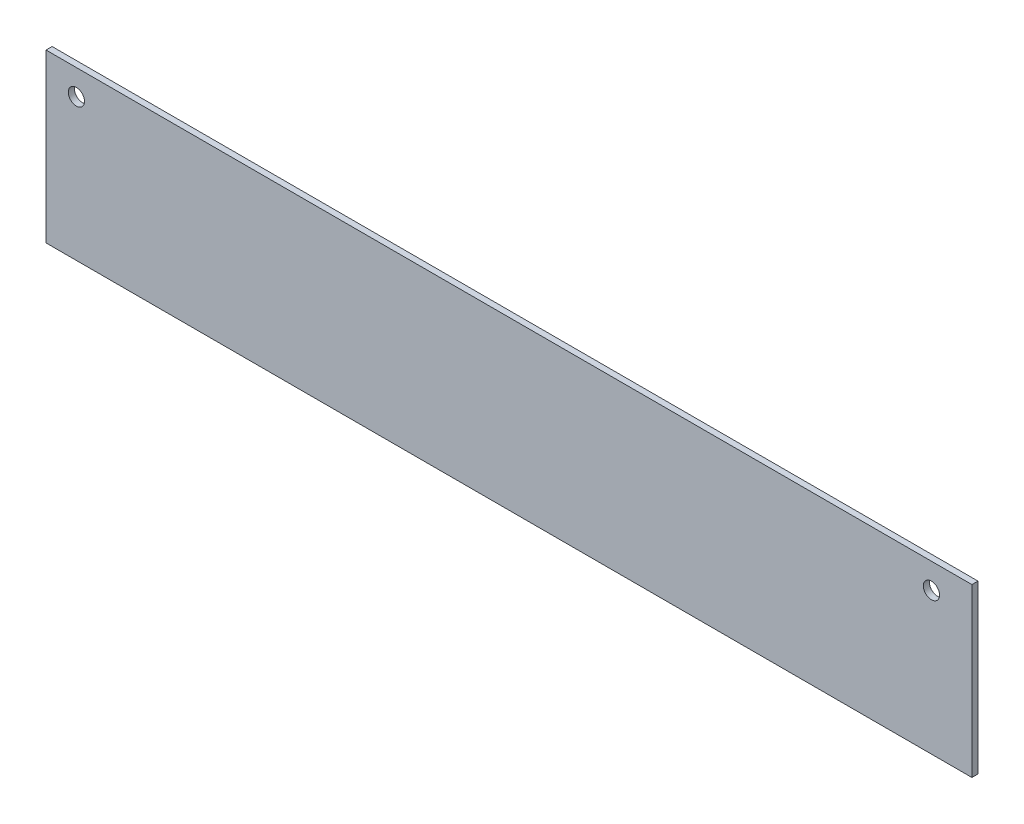
from build123d import *

# Parameters (mm, degrees)
SKETCH1_W           = 457.2
SKETCH1_H           = 82.5
BOSS_EXTRUDE1_DEPTH = 3
SKETCH2_R           = 4
CUT_EXTRUDE1_DEPTH  = 233.311262103


with BuildPart() as part:
    # Sketch1 → Boss-Extrude1 (new body)
    with BuildSketch(Plane.XY):
        Rectangle(SKETCH1_W, SKETCH1_H)
    extrude(amount=BOSS_EXTRUDE1_DEPTH)

    # Sketch2 → Cut-Extrude1 (cut, through all)
    with BuildSketch(Plane.XY.offset(3)):
        with Locations((-213.6, 28.75)):
            Circle(SKETCH2_R)
        with Locations((208.6, 28.75)):
            Circle(SKETCH2_R)
    extrude(amount=-CUT_EXTRUDE1_DEPTH, mode=Mode.SUBTRACT)


solid = part.part
